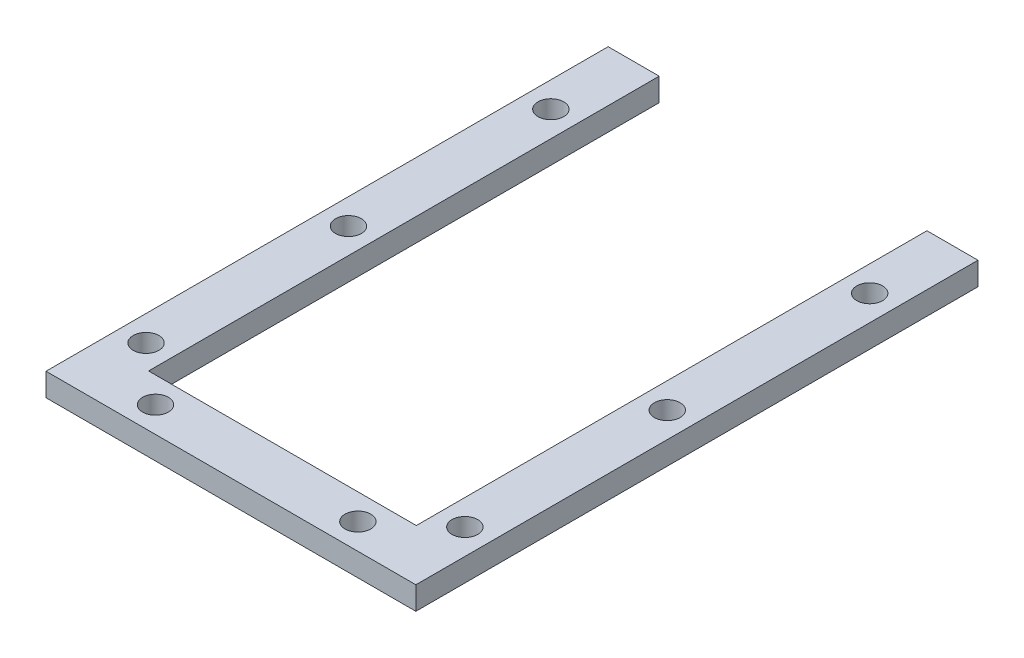
from build123d import *

# Parameters (mm, degrees)
SKETCH2_R           = 1.4
BOSS_EXTRUDE1_DEPTH = 2.5


with BuildPart() as part:
    # Sketch2 → Boss-Extrude1 (new body)
    with BuildSketch(Plane(origin=(0, 0, 0), x_dir=(1, 0, 0), z_dir=(0, 1, 0))):
        Polygon((-20.1, 55.5), (-20.1, -5.6), (20.1, -5.6), (20.1, 55.5), (14.55, 55.5), (14.55, 0), (-14.55, 0), (-14.55, 55.5), align=None)
        with Locations(Location((-11, -2.8, 0), (0, 0, 270))):
            Circle(SKETCH2_R, mode=Mode.SUBTRACT)
        with Locations(Location((11, -2.8, 0), (0, 0, 90))):
            Circle(SKETCH2_R, mode=Mode.SUBTRACT)
        with Locations(Location((-17.325, 46.5, 0), (0, 0, 270))):
            Circle(SKETCH2_R, mode=Mode.SUBTRACT)
        with Locations(Location((-17.325, 24.5, 0), (0, 0, 270))):
            Circle(SKETCH2_R, mode=Mode.SUBTRACT)
        with Locations(Location((-17.325, 2.5, 0), (0, 0, 270))):
            Circle(SKETCH2_R, mode=Mode.SUBTRACT)
        with Locations(Location((17.325, 46.5, 0), (0, 0, 90))):
            Circle(SKETCH2_R, mode=Mode.SUBTRACT)
        with Locations(Location((17.325, 24.5, 0), (0, 0, 90))):
            Circle(SKETCH2_R, mode=Mode.SUBTRACT)
        with Locations(Location((17.325, 2.5, 0), (0, 0, 90))):
            Circle(SKETCH2_R, mode=Mode.SUBTRACT)
    extrude(amount=BOSS_EXTRUDE1_DEPTH)


solid = part.part
